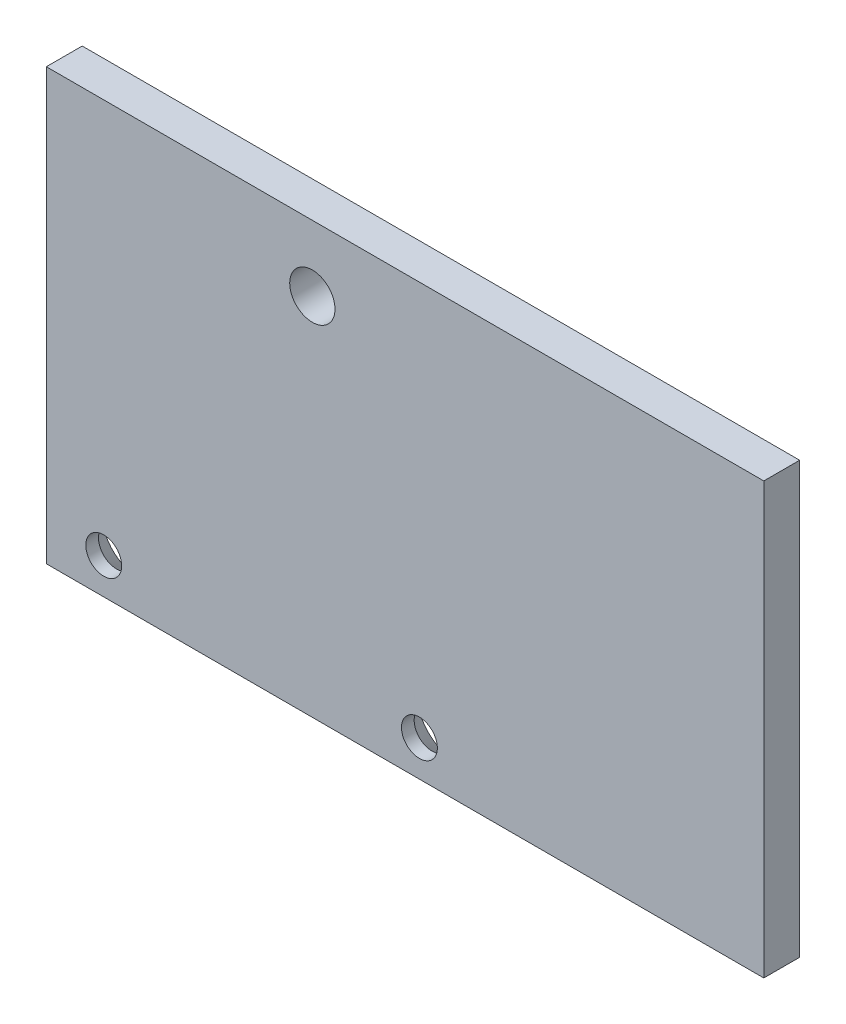
from build123d import *

# Parameters (mm, degrees)
SKETCH1_W                            = 127
SKETCH1_H                            = 76.2
BOSS_EXTRUDE1_DEPTH                  = 6.35
CUT_EXTRUDE1_DEPTH                   = 149.24224263
CUT_EXTRUDE1_DEPTH_BACK              = 149.24224263
SKETCH4_R                            = 4.01
F_1_4_0_25_DIAMETER_HOLE1_AT_2_COUNT = 2
F_1_4_0_25_DIAMETER_HOLE1_AT_2_PITCH = 55.88


with BuildPart() as part:
    # Sketch1 → Boss-Extrude1 (new body)
    with BuildSketch(Plane.XY):
        with Locations((-63.5, 38.1)):
            Rectangle(SKETCH1_W, SKETCH1_H)
    extrude(amount=BOSS_EXTRUDE1_DEPTH)

    # Sketch4 → Cut-Extrude1 (cut, two sides: drawn at the far end of the back side and taken through both)
    with BuildSketch(Plane(origin=(0, 0, 0), x_dir=(-1, 0, 0), z_dir=(0, 0, -1)).offset(-CUT_EXTRUDE1_DEPTH_BACK)):
        with Locations((79.912500047, 64.573038165)):
            Circle(SKETCH4_R)
    extrude(amount=CUT_EXTRUDE1_DEPTH + CUT_EXTRUDE1_DEPTH_BACK, mode=Mode.SUBTRACT)

    # Sketch8 → 1/4 (0.25) Diameter Hole1 (revolve, cut)
    with BuildSketch(Plane(origin=(-116.84, 6.35, 0), x_dir=(0, 1, 0), z_dir=(1, 0, 0))):
        Polygon((0, 0), (0, 6.35), (3.175, 6.35), (3.175, 4.105319735), (6.7437, 0), align=None)
    f_1_4_0_25_diameter_hole1 = revolve(axis=Axis((-116.84, 6.35, -6.35), (0, 0, 1)), mode=Mode.SUBTRACT)

    # 1/4 (0.25) Diameter Hole1 at 2: 1/4 (0.25) Diameter Hole1 ×2
    with Locations(*[(i * F_1_4_0_25_DIAMETER_HOLE1_AT_2_PITCH, 0, 0) for i in range(1, F_1_4_0_25_DIAMETER_HOLE1_AT_2_COUNT)]):
        add(f_1_4_0_25_diameter_hole1, mode=Mode.SUBTRACT)


solid = part.part
